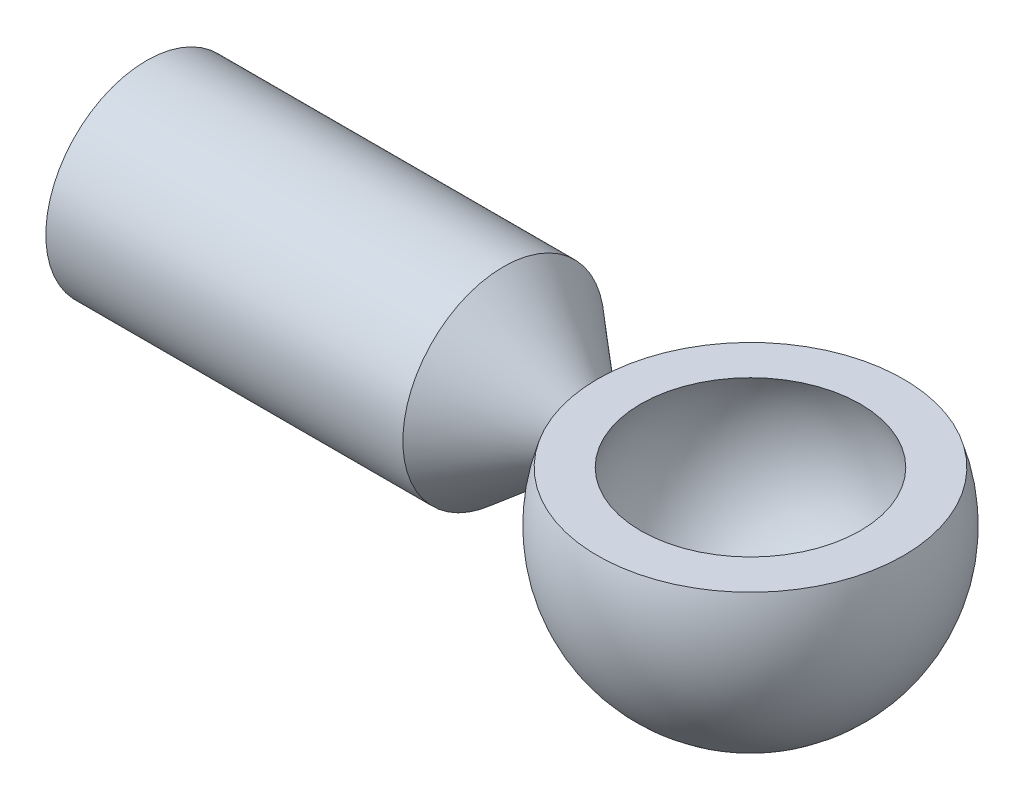
from build123d import *

# Parameters (mm, degrees)
SKETCH_4_R          = 3
CUT_EXTRUDE_1_DEPTH = 15


with BuildPart() as part:
    # 草图1 → 旋转1 (revolve)
    with BuildSketch(Plane.XY):
        with BuildLine():
            Line((-5.454356057, 2.5), (-7.599342077, 2.5))
            ThreePointArc((-7.599342077, 2.5), (-6.480740698, -4.69041576), (0, -8))
            Line((0, -8), (0, -6))
            ThreePointArc((0, -6), (-5.049752469, -3.240370349), (-5.454356057, 2.5))
        make_face()
    revolve(axis=Axis((0, 0, 0), (0, -1, 0)))

    # 草图2 → 旋转2 (revolve)
    with BuildSketch(Plane.XY, mode=Mode.PRIVATE) as revolve_2_sk:
        Polygon((-7.5, 0), (-7.5, 1), (-12.26701437, 5), (-30, 5), (-30, 0), align=None)
    revolve(revolve_2_sk.sketch.rotate(Axis((-7.5, 0, 0), (-1, 0, 0)), 180), axis=Axis((-7.5, 0, 0), (-1, 0, 0)))

    # 草图4 → 切除-拉伸1 (cut)
    with BuildSketch(Plane.ZY.offset(30)):
        with Locations(Location((0, 0, 0), (0, 0, 270))):
            Circle(SKETCH_4_R)
    extrude(amount=-CUT_EXTRUDE_1_DEPTH, mode=Mode.SUBTRACT)


solid = part.part
